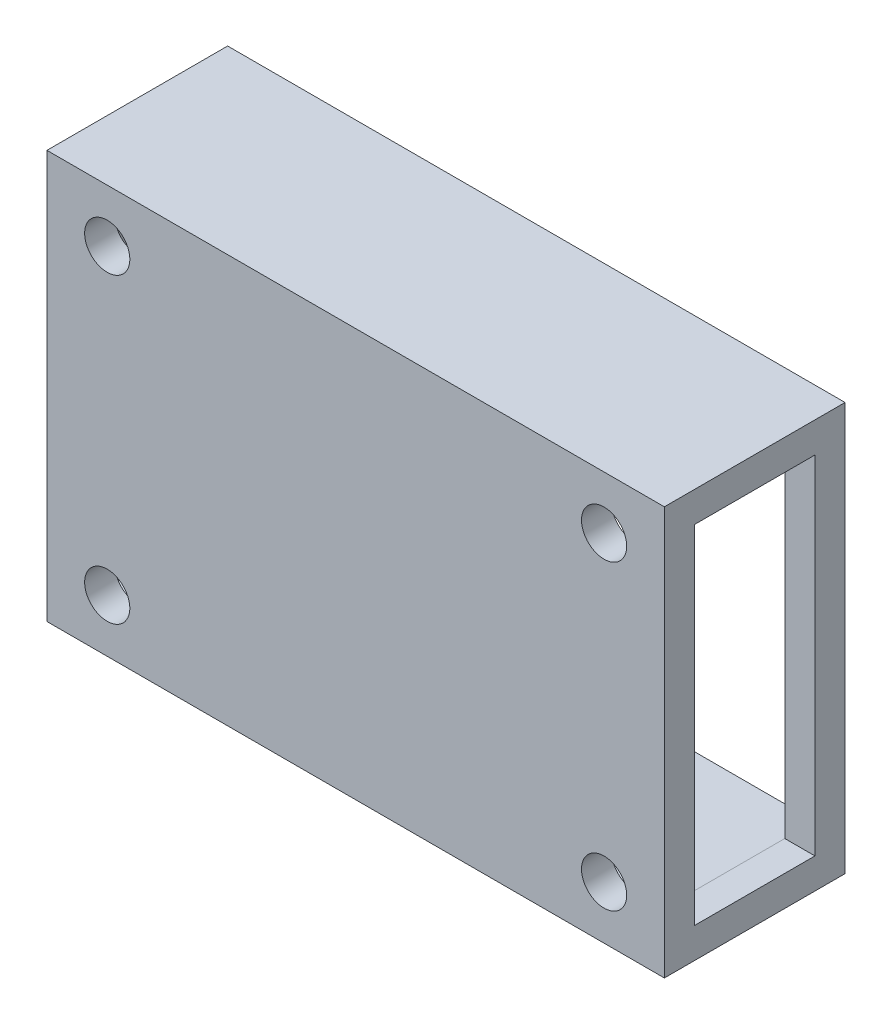
from build123d import *

# Parameters (mm, degrees)
ESBO_O1_W                = 35
ESBO_O1_H                = 25.1
RESSALTO_EXTRUS_O1_DEPTH = 2
ESBO_O2_R                = 1.5
CORTE_EXTRUS_O1_DEPTH    = 2
ESBO_O3_W                = 2.002857319
ESBO_O3_H                = 25.1
RESSALTO_EXTRUS_O2_DEPTH = 2
CORTE_EXTRUS_O2_DEPTH    = 2
ESBO_O5_W                = 4
ESBO_O5_H                = 25.1
RESSALTO_EXTRUS_O3_DEPTH = 2
ESBO_O6_W                = 41.002857319
ESBO_O6_H                = 25.1
RESSALTO_EXTRUS_O4_DEPTH = 10
ESBO_O7_W                = 17.37169178
ESBO_O7_H                = 25.1
RESSALTO_EXTRUS_O5_DEPTH = 2
ESBO_O8_R                = 1.5
CORTE_EXTRUS_O3_DEPTH    = 20
RESSALTO_EXTRUS_O6_START = -10
RESSALTO_EXTRUS_O6_DEPTH = 10
ESBO_O10_W               = 2
ESBO_O10_H               = 2
RESSALTO_EXTRUS_O7_DEPTH = 10
ESBO_O11_R               = 1.5
CORTE_EXTRUS_O4_DEPTH    = 15
ESBO_O12_W               = 41.002857319
ESBO_O12_H               = 1
RESSALTO_EXTRUS_O8_DEPTH = 12
CORTE_EXTRUS_O5_DEPTH    = 10
ESBO_O14_W               = 8
ESBO_O14_H               = 23.06
CORTE_EXTRUS_O6_DEPTH    = 10


with BuildPart() as part:
    # Esboço1 → Ressalto-extrusão1 (new body)
    with BuildSketch(Plane.XY):
        with Locations((17.5, 12.55)):
            Rectangle(ESBO_O1_W, ESBO_O1_H)
    extrude(amount=RESSALTO_EXTRUS_O1_DEPTH)

    # Esboço2 → Corte-extrusão1 (cut)
    with BuildSketch(Plane.XY.offset(2)):
        with Locations((2.13, 22.97)):
            Circle(ESBO_O2_R)
        with Locations(Location((2.13, 2.13, 0), (0, 0, 180))):
            Circle(ESBO_O2_R)
    extrude(amount=-CORTE_EXTRUS_O1_DEPTH, mode=Mode.SUBTRACT)

    # Esboço3 → Ressalto-extrusão2 (add)
    with BuildSketch(Plane.XY.offset(2)):
        with Locations((-1.00142866, 12.55)):
            Rectangle(ESBO_O3_W, ESBO_O3_H)
    extrude(amount=-RESSALTO_EXTRUS_O2_DEPTH)

    # Esboço4 → Corte-extrusão2 (cut)
    with BuildSketch(Plane.XY.offset(2)):
        Polygon((1.597142681, 12.55), (1.597142681, 19.05), (14.597142681, 19.05), (14.597142681, 6.05), (1.597142681, 6.05), align=None)
    extrude(amount=-CORTE_EXTRUS_O2_DEPTH, mode=Mode.SUBTRACT)

    # Esboço5 → Ressalto-extrusão3 (add)
    with BuildSketch(Plane.XY.offset(2)):
        with Locations((37, 12.55)):
            Rectangle(ESBO_O5_W, ESBO_O5_H)
    extrude(amount=-RESSALTO_EXTRUS_O3_DEPTH)

    # Esboço6 → Ressalto-extrusão4 (add)
    with BuildSketch(Plane(origin=(0, 0, 0), x_dir=(-1, 0, 0), z_dir=(0, 0, -1))):
        with Locations((-18.49857134, 12.55)):
            Rectangle(ESBO_O6_W, ESBO_O6_H)
        with BuildLine():
            Line((-32.997142681, 22.1), (-4, 22.1))
            ThreePointArc((-4, 22.1), (-2, 20.1), (0, 22.1))
            Line((0, 22.1), (0, 3))
            ThreePointArc((0, 3), (-2, 5), (-4, 3))
            Line((-4, 3), (-32.997142681, 3))
            ThreePointArc((-32.997142681, 3), (-34.997142681, 5), (-36.997142681, 3))
            Line((-36.997142681, 3), (-36.997142681, 22.1))
            ThreePointArc((-36.997142681, 22.1), (-34.997142681, 20.1), (-32.997142681, 22.1))
        make_face(mode=Mode.SUBTRACT)
    extrude(amount=RESSALTO_EXTRUS_O4_DEPTH)

    # Esboço7 → Ressalto-extrusão5 (add)
    with BuildSketch(Plane.XY.offset(2)):
        with Locations((6.682988571, 12.55)):
            Rectangle(ESBO_O7_W, ESBO_O7_H)
    extrude(amount=-RESSALTO_EXTRUS_O5_DEPTH)

    # Esboço8 → Corte-extrusão3 (cut)
    with BuildSketch(Plane(origin=(0, 0, -10), x_dir=(-1, 0, 0), z_dir=(0, 0, -1))):
        with Locations((-2, 22.585)):
            Circle(ESBO_O8_R)
        with Locations((-2, 2.515)):
            Circle(ESBO_O8_R)
    extrude(amount=-CORTE_EXTRUS_O3_DEPTH, mode=Mode.SUBTRACT)

    # Esboço9 → Ressalto-extrusão6 (add)
    with BuildSketch(Plane(origin=(0, 0, -10), x_dir=(-1, 0, 0), z_dir=(0, 0, -1)).offset(RESSALTO_EXTRUS_O6_START)):
        with BuildLine():
            Line((-2, 20.1), (0, 20.1))
            Line((0, 20.1), (0, 22.1))
            ThreePointArc((0, 22.1), (-0.585786438, 20.685786438), (-2, 20.1))
        make_face()
        with BuildLine():
            Line((0, 5), (0, 3))
            ThreePointArc((0, 3), (-0.585786438, 4.414213562), (-2, 5))
            Line((-2, 5), (0, 5))
        make_face()
    extrude(amount=RESSALTO_EXTRUS_O6_DEPTH)

    # Esboço10 → Ressalto-extrusão7 (add)
    with BuildSketch(Plane(origin=(0, 0, -10), x_dir=(-1, 0, 0), z_dir=(0, 0, -1))):
        Polygon((-34.997142681, 20.1), (-36.997142681, 20.1), (-36.997142681, 22.1), align=None)
        with Locations((-35.997142681, 4)):
            Rectangle(ESBO_O10_W, ESBO_O10_H)
    extrude(amount=-RESSALTO_EXTRUS_O7_DEPTH)

    # Esboço11 → Corte-extrusão4 (cut)
    with BuildSketch(Plane(origin=(0, 0, -10), x_dir=(-1, 0, 0), z_dir=(0, 0, -1))):
        with Locations((-34.997142681, 22.585)):
            Circle(ESBO_O11_R)
        with Locations((-34.997142681, 2.515)):
            Circle(ESBO_O11_R)
    extrude(amount=-CORTE_EXTRUS_O4_DEPTH, mode=Mode.SUBTRACT)

    # Esboço12 → Ressalto-extrusão8 (add)
    with BuildSketch(Plane(origin=(0, 0, -10), x_dir=(-1, 0, 0), z_dir=(0, 0, -1))):
        with Locations((-18.49857134, 25.6)):
            Rectangle(ESBO_O12_W, ESBO_O12_H)
        with Locations((-18.49857134, -0.5)):
            Rectangle(ESBO_O12_W, ESBO_O12_H)
    extrude(amount=-RESSALTO_EXTRUS_O8_DEPTH)

    # Esboço13 → Corte-extrusão5 (cut)
    with BuildSketch(Plane(origin=(0, 0, -10), x_dir=(-1, 0, 0), z_dir=(0, 0, -1))):
        Polygon((-2, 24.085), (0, 24.085), (0, 1.015), (-2, 1.015), (-36.997142681, 1.015), (-36.997142681, 24.085), align=None)
    extrude(amount=-CORTE_EXTRUS_O5_DEPTH, mode=Mode.SUBTRACT)

    # Esboço14 → Corte-extrusão6 (cut)
    with BuildSketch(Plane(origin=(39, 0, 0), x_dir=(0, 0, -1), z_dir=(1, 0, 0))):
        with Locations((4, 12.55)):
            Rectangle(ESBO_O14_W, ESBO_O14_H)
    extrude(amount=-CORTE_EXTRUS_O6_DEPTH, mode=Mode.SUBTRACT)


solid = part.part
